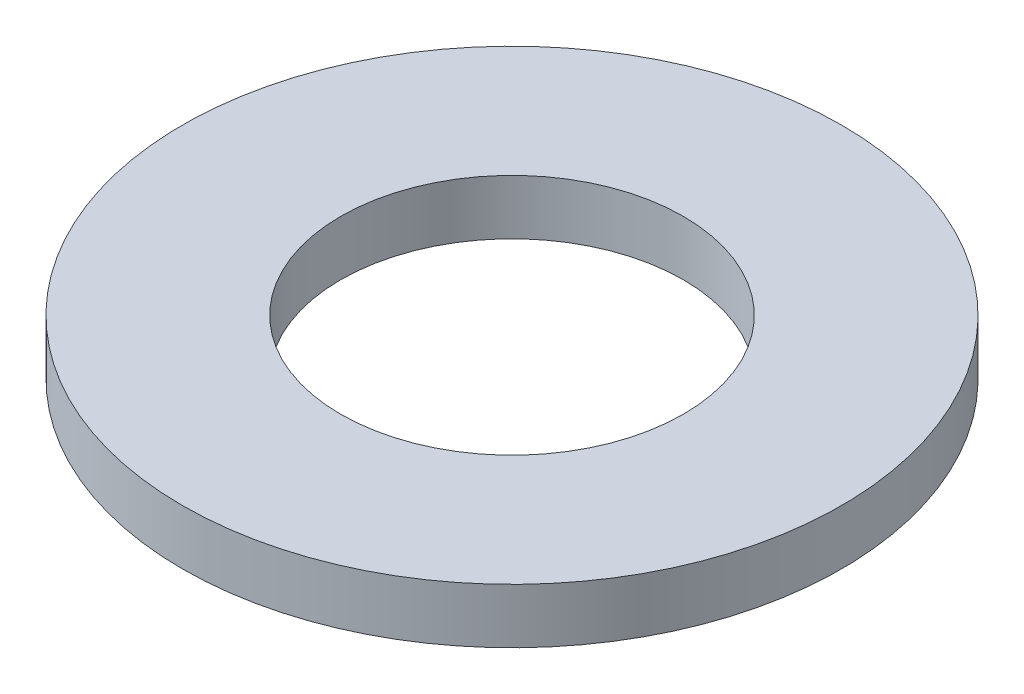
from build123d import *

# Parameters (mm, degrees)
SKETCH1_R           = 76.2
SKETCH1_R_2         = 39.624
BOSS_EXTRUDE1_DEPTH = 12.7


with BuildPart() as part:
    # Sketch1 → Boss-Extrude1 (new body)
    with BuildSketch(Plane(origin=(0, 0, 0), x_dir=(1, 0, 0), z_dir=(0, 1, 0))):
        with Locations(Location((0, 0, 0), (0, 0, 270))):
            Circle(SKETCH1_R)
        with Locations(Location((0, 0, 0), (0, 0, 270))):
            Circle(SKETCH1_R_2, mode=Mode.SUBTRACT)
    extrude(amount=BOSS_EXTRUDE1_DEPTH)


solid = part.part
